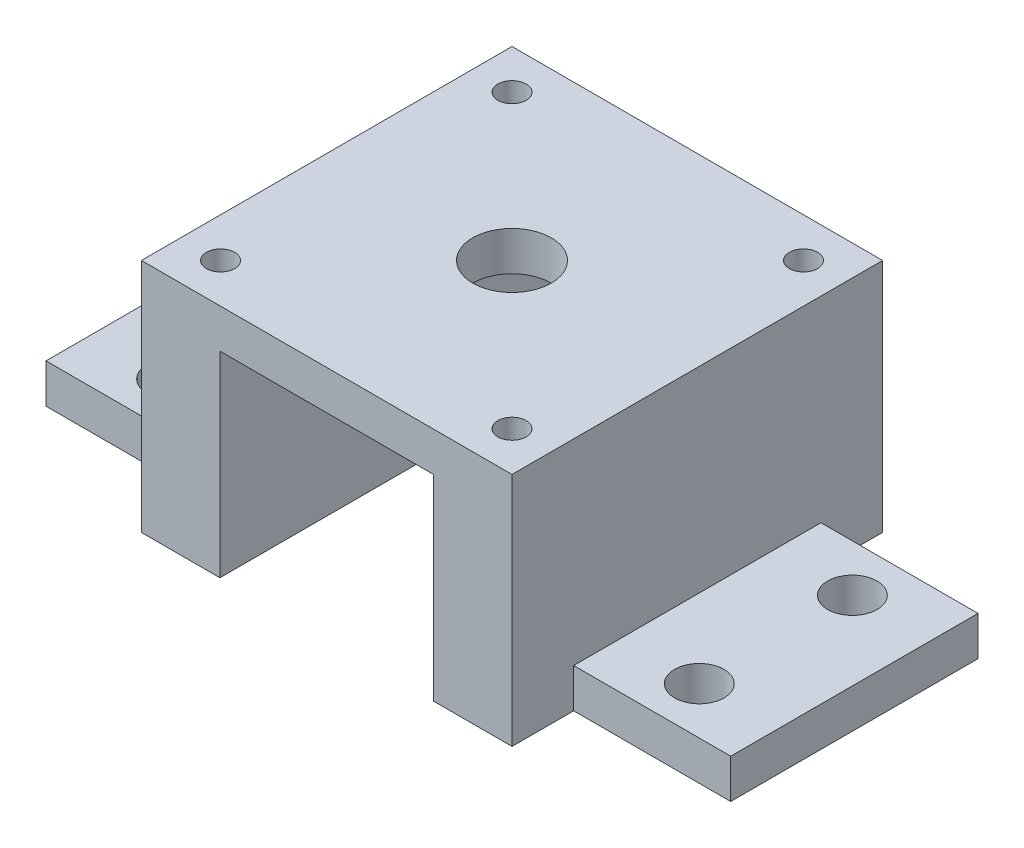
from build123d import *

# Parameters (mm, degrees)
SKETCH1_W           = 59.944
SKETCH1_H           = 59.944
BOSS_EXTRUDE1_DEPTH = 38.1
SKETCH2_W           = 34.544
SKETCH2_H           = 31.75
CUT_EXTRUDE1_DEPTH  = 93.941789697
SKETCH3_R           = 6.35
CUT_EXTRUDE2_DEPTH  = 80.152691578
SKETCH4_W           = 40
SKETCH4_H           = 6.35
BOSS_EXTRUDE2_DEPTH = 25.4
SKETCH5_W           = 40
SKETCH5_H           = 6.35
BOSS_EXTRUDE3_DEPTH = 25.4
SKETCH6_R           = 4
CUT_EXTRUDE3_DEPTH  = 98.529053538
SKETCH7_R           = 2.286
CUT_EXTRUDE4_DEPTH  = 12.7


with BuildPart() as part:
    # Sketch1 → Boss-Extrude1 (new body)
    with BuildSketch(Plane(origin=(0, 0, 0), x_dir=(1, 0, 0), z_dir=(0, 1, 0))):
        with Locations((-29.972, -4.96015493)):
            Rectangle(SKETCH1_W, SKETCH1_H)
    extrude(amount=BOSS_EXTRUDE1_DEPTH)

    # Sketch2 → Cut-Extrude1 (cut, through all)
    with BuildSketch(Plane.XY.offset(34.93215493)):
        with Locations((-29.972, 15.875)):
            Rectangle(SKETCH2_W, SKETCH2_H)
    extrude(amount=-CUT_EXTRUDE1_DEPTH, mode=Mode.SUBTRACT)

    # Sketch3 → Cut-Extrude2 (cut, through all)
    with BuildSketch(Plane(origin=(0, 38.1, 0), x_dir=(1, 0, 0), z_dir=(0, 1, 0))):
        with Locations(Location((-29.972, -4.96015493, 0), (0, 0, 270))):
            Circle(SKETCH3_R)
    extrude(amount=-CUT_EXTRUDE2_DEPTH, mode=Mode.SUBTRACT)

    # Sketch4 → Boss-Extrude2 (add)
    with BuildSketch(Plane(origin=(0, 0, 0), x_dir=(0, 0, -1), z_dir=(1, 0, 0))):
        with Locations((-4.960154808, 3.175)):
            Rectangle(SKETCH4_W, SKETCH4_H)
    extrude(amount=BOSS_EXTRUDE2_DEPTH)

    # Sketch5 → Boss-Extrude3 (add)
    with BuildSketch(Plane.ZY.offset(59.944)):
        with Locations((4.960154808, 3.175)):
            Rectangle(SKETCH5_W, SKETCH5_H)
    extrude(amount=BOSS_EXTRUDE3_DEPTH)

    # Sketch6 → Cut-Extrude3 (cut, through all)
    with BuildSketch(Plane(origin=(0, 6.35, 0), x_dir=(1, 0, 0), z_dir=(0, 1, 0))):
        with Locations(Location((-72.644, 7.419845192, 0), (0, 0, 270))):
            Circle(SKETCH6_R)
        with Locations(Location((-72.644, -17.340154808, 0), (0, 0, 270))):
            Circle(SKETCH6_R)
        with Locations(Location((12.7, 7.419845192, 0), (0, 0, 270))):
            Circle(SKETCH6_R)
        with Locations(Location((12.7, -17.340154808, 0), (0, 0, 270))):
            Circle(SKETCH6_R)
    extrude(amount=-CUT_EXTRUDE3_DEPTH, mode=Mode.SUBTRACT)

    # Sketch7 → Cut-Extrude4 (cut)
    with BuildSketch(Plane(origin=(0, 38.1, 0), x_dir=(1, 0, 0), z_dir=(0, 1, 0))):
        with Locations(Location((-53.5432, 18.61104507, 0), (0, 0, 270))):
            Circle(SKETCH7_R)
        with Locations(Location((-6.4008, -28.53135493, 0), (0, 0, 270))):
            Circle(SKETCH7_R)
        with Locations(Location((-53.5432, -28.53135493, 0), (0, 0, 270))):
            Circle(SKETCH7_R)
        with Locations(Location((-6.4008, 18.61104507, 0), (0, 0, 270))):
            Circle(SKETCH7_R)
    extrude(amount=-CUT_EXTRUDE4_DEPTH, mode=Mode.SUBTRACT)


solid = part.part
